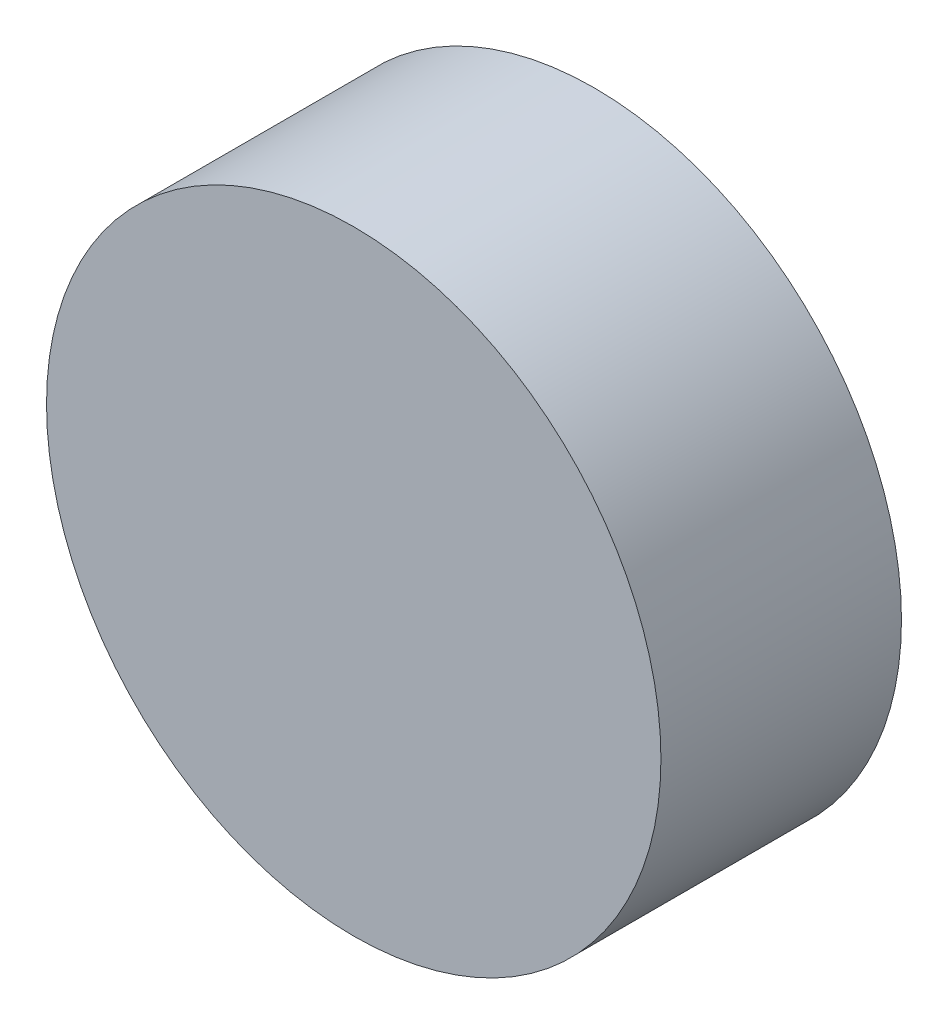
from build123d import *

# Parameters (mm, degrees)
SKETCH_1_R      = 53
EXTRUDE_1_DEPTH = 41.5


with BuildPart() as part:
    # 草图1 → 凸台-拉伸1 (new body)
    with BuildSketch(Plane.XY):
        Circle(SKETCH_1_R)
    extrude(amount=EXTRUDE_1_DEPTH)


solid = part.part
